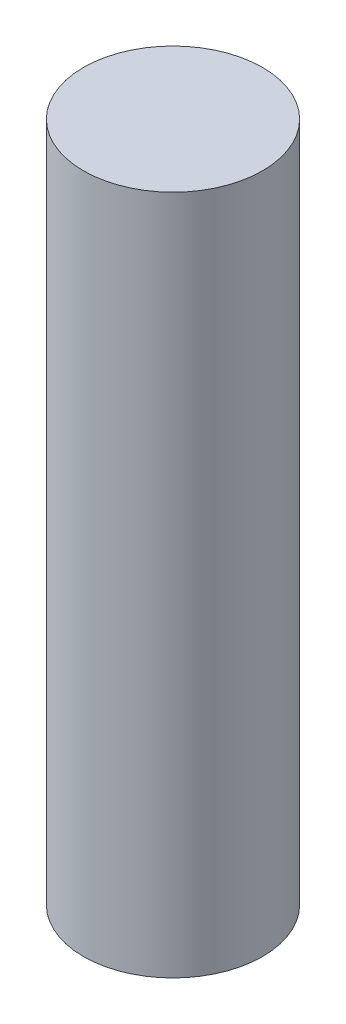
from build123d import *

# Parameters (mm, degrees)
SKETCH1_R           = 12.7
BOSS_EXTRUDE1_DEPTH = 96.52


with BuildPart() as part:
    # Sketch1 → Boss-Extrude1 (new body)
    with BuildSketch(Plane(origin=(0, 0, 0), x_dir=(1, 0, 0), z_dir=(0, 1, 0))):
        with Locations(Location((0, 0, 0), (0, 0, 90))):
            Circle(SKETCH1_R)
    extrude(amount=BOSS_EXTRUDE1_DEPTH)


solid = part.part
